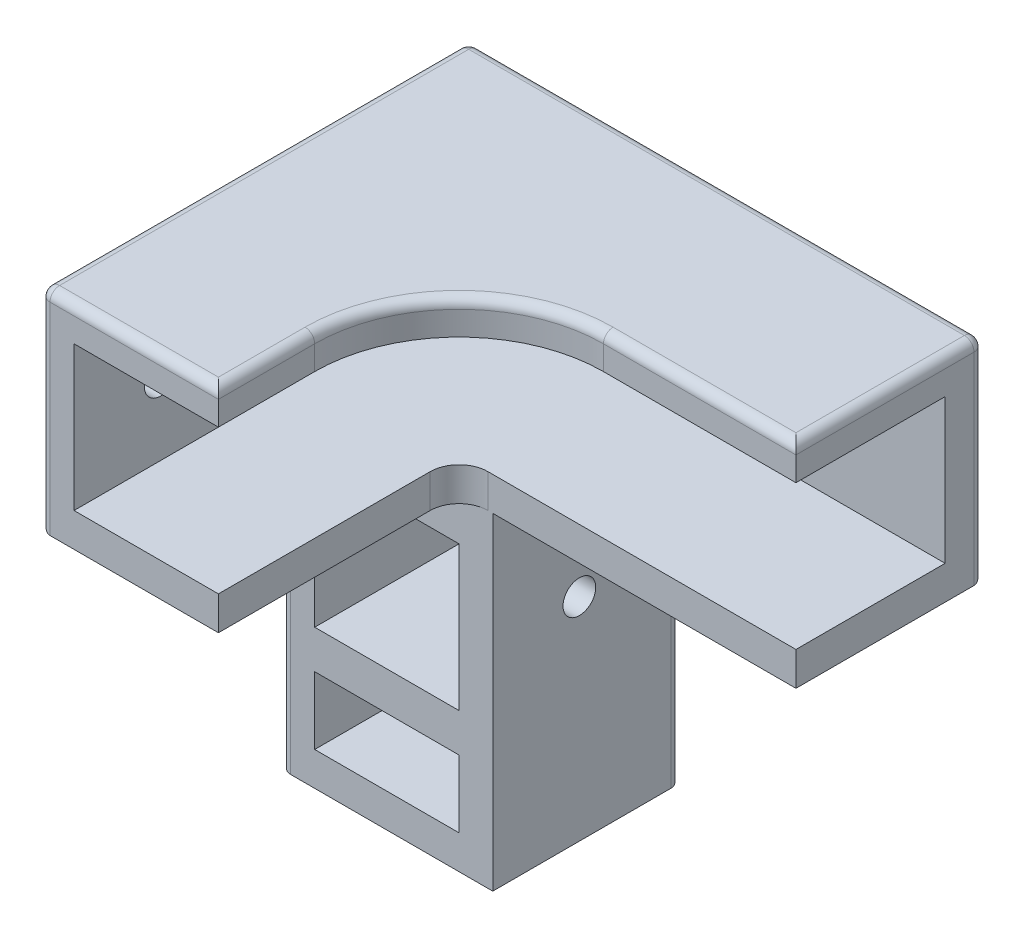
from build123d import *

# Parameters (mm, degrees)
BOSS_EXTRUDE1_DEPTH  = 19.5
SKETCH3_W            = 18.5
SKETCH3_H            = 22
BOSS_EXTRUDE2_DEPTH  = 25
SKETCH5_W            = 50
SKETCH5_H            = 15
SKETCH5_W_2          = 15
SKETCH5_H_2          = 7
CUT_EXTRUDE1_DEPTH   = 40.5
BOSS_EXTRUDE4_DEPTH  = 3.5
BOSS_EXTRUDE5_DEPTH  = 3.5
BOSS_EXTRUDE6_DEPTH  = 3.5
FILLET3_R            = 3
CUT_EXTRUDE3_DEPTH   = 1
SKETCH12_R           = 1.7
CUT_EXTRUDE4_DEPTH   = 5
SKETCH13_R           = 1.7
CUT_EXTRUDE5_DEPTH   = 45
SKETCH14_R           = 1.7
CUT_EXTRUDE6_DEPTH   = 45
SKETCH15_R           = 1.7
CUT_EXTRUDE7_DEPTH   = 4
FILLET3_OF_MIRROR2_R = 3
SKETCH16_W           = 70.294928241
SKETCH16_H           = 57.866283398
CUT_EXTRUDE8_DEPTH   = 72
CUT_EXTRUDE9_DEPTH   = 1
FILLET4_R            = 1


with BuildPart() as part:
    # Sketch1 → Boss-Extrude1 (new body)
    with BuildSketch(Plane.XY):
        Polygon((-5.699410772, 32.916253451), (16.300589228, 32.916253451), (16.300589228, -23.083746549), (-5.699410772, -23.083746549), (-5.699410772, 10.916253451), (-37.199410772, 10.916253451), (-37.199410772, 32.916253451), align=None)
    boss_extrude1 = extrude(amount=BOSS_EXTRUDE1_DEPTH)

    # Sketch3 → Boss-Extrude2 (add)
    with BuildSketch(Plane.XY.offset(19.5)):
        with Locations((7.050589228, 21.916253451)):
            Rectangle(SKETCH3_W, SKETCH3_H)
    boss_extrude2 = extrude(amount=BOSS_EXTRUDE2_DEPTH)

    # Sketch5 → Cut-Extrude1 (cut)
    with BuildSketch(Plane.XY.offset(44.5)):
        with Locations((-12.199410772, 21.916253451)):
            Rectangle(SKETCH5_W, SKETCH5_H)
        with Locations((5.300589228, -1.083746549)):
            Rectangle(SKETCH5_W_2, SKETCH5_H)
        with Locations((5.300589228, -16.083746549)):
            Rectangle(SKETCH5_W_2, SKETCH5_H_2)
    cut_extrude1 = extrude(amount=-CUT_EXTRUDE1_DEPTH, mode=Mode.SUBTRACT)

    # Sketch7 → Boss-Extrude4 (add)
    with BuildSketch(Plane(origin=(16.300589228, 0, 0), x_dir=(0, 0, -1), z_dir=(1, 0, 0))):
        with BuildLine():
            Line((-34.5, 10.916253451), (-19.5, 10.916253451))
            Line((-19.5, 10.916253451), (-19.5, -4.083746549))
            ThreePointArc((-19.5, -4.083746549), (-23.893398282, 6.522855169), (-34.5, 10.916253451))
        make_face()
    boss_extrude4 = extrude(amount=-BOSS_EXTRUDE4_DEPTH)

    # Sketch8 → Boss-Extrude5 (add)
    with BuildSketch(Plane(origin=(0, 0, 0), x_dir=(-1, 0, 0), z_dir=(0, 0, -1))):
        with BuildLine():
            Line((5.699410772, 10.916253451), (20.699410772, 10.916253451))
            ThreePointArc((20.699410772, 10.916253451), (10.092809055, 6.522855169), (5.699410772, -4.083746549))
            Line((5.699410772, -4.083746549), (5.699410772, 10.916253451))
        make_face()
    boss_extrude5 = extrude(amount=-BOSS_EXTRUDE5_DEPTH)

    # Sketch9 → Boss-Extrude6 (add)
    with BuildSketch(Plane(origin=(0, 32.916253451, 0), x_dir=(1, 0, 0), z_dir=(0, 1, 0))):
        with BuildLine():
            Line((-2.199410772, -34.5), (-2.199410772, -19.5))
            Line((-2.199410772, -19.5), (-17.199410772, -19.5))
            ThreePointArc((-17.199410772, -19.5), (-6.592809055, -23.893398282), (-2.199410772, -34.5))
        make_face()
    boss_extrude6 = extrude(amount=-BOSS_EXTRUDE6_DEPTH)

    # Fillet3
    fillet3_edges = [part.edges().sort_by_distance(p)[0] for p in [
        (-2.199410772, 12.666253451, 19.5),
    ]]
    fillet(fillet3_edges, radius=FILLET3_R)

    # Sketch11 → Cut-Extrude3 (cut)
    # profile 1 of 4: a face of its own
    with BuildSketch(Plane(origin=(0, 0, 0), x_dir=(-1, 0, 0), z_dir=(0, 0, -1))):
        Polygon((-10.800589228, -18.789996549), (-10.800589228, -16.838073472), (-2.43039692, -14.652977318), (-10.800589228, -12.463073472), (-10.800589228, -10.515958087), (1.199410772, -8.729900395), (1.199410772, -10.602496549), (-6.379916151, -11.729900395), (1.199410772, -13.715477318), (1.199410772, -15.597688857), (-6.379916151, -17.576054241), (1.199410772, -18.703458087), (1.199410772, -20.576054241), align=None)
    # profile 2 of 4: a face of its own
    with BuildSketch(Plane(origin=(0, 0, 0), x_dir=(-1, 0, 0), z_dir=(0, 0, -1))):
        with BuildLine():
            Line((-10.800589228, -7.991438857), (-10.800589228, -5.952977318))
            add(Edge.make_bspline(
                [(-10.800589228, -5.952977318), (-10.800005012, -5.818337024), (-10.798881276, -5.559357226), (-10.780939362, -5.185841664), (-10.756194453, -4.841644627), (-10.717588986, -4.528141475), (-10.670910939, -4.244422827), (-10.610297955, -3.991812577), (-10.542991354, -3.767135176), (-10.432899575, -3.510089545), (-10.261344606, -3.2204116), (-9.993854575, -2.916502166), (-9.674999978, -2.642644015), (-9.298421338, -2.412342144), (-8.876833149, -2.221736808), (-8.412796045, -2.089022583), (-7.914245505, -2.00467731), (-7.569376461, -1.995936272), (-7.391935381, -1.991438857)],
                knots=[0, 0, 0, 0, 1.067446855, 2.053227611, 2.964447842, 3.802928181, 4.55705831, 5.242813606, 5.861740442, 6.41401137, 7.456762865, 8.515266784, 9.610284097, 10.777391769, 12.003071174, 13.267653188, 14.594160368, 16, 16, 16, 16], degree=3))
            add(Edge.make_bspline(
                [(-7.391935381, -1.991438857), (-7.297355032, -1.992855248), (-7.111944506, -1.99563187), (-6.839545611, -2.016474255), (-6.57922187, -2.056818659), (-6.329385024, -2.104637483), (-6.092864844, -2.173393793), (-5.86736032, -2.254741183), (-5.654862929, -2.353204183), (-5.453365078, -2.465039747), (-5.262464902, -2.588608019), (-5.086843378, -2.732896484), (-4.9205107, -2.888692529), (-4.766123648, -3.059365613), (-4.626046251, -3.246963608), (-4.496602326, -3.448494847), (-4.377999142, -3.665222723), (-4.310704173, -3.817832702), (-4.276550766, -3.895285011)],
                knots=[0, 0, 0, 0, 1.163181294, 2.28024169, 3.356120165, 4.401649984, 5.406013808, 6.381787017, 7.347406326, 8.282525473, 9.21452408, 10.139462981, 11.073595085, 12.01554303, 12.965498088, 13.949545959, 14.959357709, 16, 16, 16, 16], degree=3))
            Line((-4.276550766, -3.895285011), (1.199410772, -1.452977318))
            Line((1.199410772, -1.452977318), (1.199410772, -3.541919626))
            Line((1.199410772, -3.541919626), (-4.031358458, -5.873650395))
            Line((-4.031358458, -5.873650395), (-4.031358458, -6.145285011))
            Line((-4.031358458, -6.145285011), (1.199410772, -6.145285011))
            Line((1.199410772, -6.145285011), (1.199410772, -7.991438857))
            Line((1.199410772, -7.991438857), (-10.800589228, -7.991438857))
        make_face()
        with BuildLine():
            Line((-6.185204612, -6.145285011), (-6.185204612, -5.515477318))
            add(Edge.make_bspline(
                [(-6.185204612, -5.515477318), (-6.186367141, -5.438550003), (-6.188596807, -5.291007573), (-6.198784481, -5.078941418), (-6.223636793, -4.886497292), (-6.255016899, -4.712471663), (-6.291026717, -4.555276318), (-6.342625913, -4.418389599), (-6.399049431, -4.298462814), (-6.489896288, -4.166118437), (-6.633796999, -4.027471922), (-6.856716063, -3.91397639), (-7.124487444, -3.84724369), (-7.317795964, -3.840947182), (-7.420781535, -3.837592703)],
                knots=[0, 0, 0, 0, 1.14443165, 2.194958024, 3.155864406, 4.02787753, 4.825710302, 5.549708663, 6.200008757, 6.791751392, 7.929772656, 9.129352395, 10.470655706, 12, 12, 12, 12], degree=3))
            add(Edge.make_bspline(
                [(-7.420781535, -3.837592703), (-7.484265153, -3.839856392), (-7.607360624, -3.844245712), (-7.785755229, -3.879686188), (-7.952879051, -3.933201989), (-8.103735349, -4.014031264), (-8.239800846, -4.109799367), (-8.356212547, -4.223260262), (-8.450592564, -4.353040951), (-8.531146795, -4.502587927), (-8.586059735, -4.694350085), (-8.620716321, -4.939833657), (-8.644326337, -5.246603017), (-8.645891807, -5.472154526), (-8.646743074, -5.594804241)],
                knots=[0, 0, 0, 0, 0.9241003, 1.791841178, 2.640927318, 3.471185814, 4.274581995, 5.058835706, 5.827024317, 6.605084504, 7.520888769, 8.714677486, 10.213517293, 12, 12, 12, 12], degree=3))
            Line((-8.646743074, -5.594804241), (-8.646743074, -6.145285011))
            Line((-8.646743074, -6.145285011), (-6.185204612, -6.145285011))
        make_face(mode=Mode.SUBTRACT)
    # profile 3 of 4: a face of its own
    with BuildSketch(Plane(origin=(0, 0, 0), x_dir=(-1, 0, 0), z_dir=(0, 0, -1))):
        with BuildLine():
            add(Edge.make_bspline(
                [(-1.262127689, -0.176054241), (-1.257647984, -0.104101941), (-1.248753835, 0.038754448), (-1.172545764, 0.242235867), (-1.05033496, 0.427832621), (-0.88404186, 0.590235666), (-0.687299125, 0.730105266), (-0.462023761, 0.828247267), (-0.217504351, 0.891566147), (-0.046993635, 0.897708021), (0.040756926, 0.900868836)],
                knots=[0, 0, 0, 0, 0.919349048, 1.825304879, 2.744940427, 3.746623331, 4.786044724, 5.819977252, 6.878086821, 8, 8, 8, 8], degree=3))
            add(Edge.make_bspline(
                [(0.040756926, 0.900868836), (0.128481887, 0.897613897), (0.299721778, 0.891260229), (0.545324854, 0.828809783), (0.771582895, 0.729449747), (0.970335119, 0.590396057), (1.138671939, 0.427821465), (1.264004419, 0.242957175), (1.339760461, 0.038678283), (1.348736151, -0.104127453), (1.353256926, -0.176054241)],
                knots=[0, 0, 0, 0, 1.117536417, 2.181440851, 3.211339843, 4.255104211, 5.260135653, 6.181815925, 7.084237479, 8, 8, 8, 8], degree=3))
            add(Edge.make_bspline(
                [(1.353256926, -0.176054241), (1.348770157, -0.248001687), (1.339861983, -0.390848436), (1.263364391, -0.595455675), (1.139460356, -0.781986068), (0.970956709, -0.945114294), (0.77080448, -1.081189928), (0.54542444, -1.181069939), (0.299695058, -1.243328016), (0.128472836, -1.249708594), (0.040756926, -1.252977318)],
                knots=[0, 0, 0, 0, 0.915447906, 1.817559426, 2.747445231, 3.752131388, 4.789763433, 5.819308596, 6.882847519, 8, 8, 8, 8], degree=3))
            add(Edge.make_bspline(
                [(0.040756926, -1.252977318), (-0.046984438, -1.249802679), (-0.217477284, -1.243633944), (-0.462123928, -1.180506316), (-0.686511891, -1.081845741), (-0.884668075, -0.944947749), (-1.051117925, -0.781983335), (-1.171904853, -0.594743665), (-1.248854997, -0.390923093), (-1.257681869, -0.248026694), (-1.262127689, -0.176054241)],
                knots=[0, 0, 0, 0, 1.121525552, 2.179269538, 3.212844836, 4.246063491, 5.247400307, 6.175325774, 7.080968592, 8, 8, 8, 8], degree=3))
        make_face()
    # profile 4 of 4: a face of its own
    with BuildSketch(Plane(origin=(0, 0, 0), x_dir=(-1, 0, 0), z_dir=(0, 0, -1))):
        with BuildLine():
            Line((-7.877512305, 3.639330374), (-7.877512305, 1.793176528))
            add(Edge.make_bspline(
                [(-7.877512305, 1.793176528), (-7.985104597, 1.806156245), (-8.194919789, 1.831467926), (-8.50062502, 1.89307865), (-8.789725475, 1.969009097), (-9.063857289, 2.060670567), (-9.32041803, 2.168002956), (-9.560895844, 2.292709709), (-9.787587098, 2.42930416), (-9.925017131, 2.537709574), (-9.99289692, 2.591253451)],
                knots=[0, 0, 0, 0, 1.13409845, 2.211599726, 3.261451197, 4.261463951, 5.235132031, 6.169264622, 7.095758548, 8, 8, 8, 8], degree=3))
            add(Edge.make_bspline(
                [(-9.99289692, 2.591253451), (-10.082013161, 2.667910273), (-10.256359415, 2.817881026), (-10.483761061, 3.07110519), (-10.676767562, 3.337669411), (-10.835123876, 3.619879277), (-10.958228421, 3.915924445), (-11.044683072, 4.227572925), (-11.099664631, 4.553240287), (-11.10537913, 4.776126179), (-11.108281535, 4.889330374)],
                knots=[0, 0, 0, 0, 1.065406432, 2.084352066, 3.078868942, 4.045367136, 5.013203651, 5.979674514, 6.9738726, 8, 8, 8, 8], degree=3))
            add(Edge.make_bspline(
                [(-11.108281535, 4.889330374), (-11.105554752, 4.990429502), (-11.100204953, 5.188780494), (-11.056686246, 5.480236578), (-10.97985421, 5.757907044), (-10.8818086, 6.026068289), (-10.745230943, 6.277428113), (-10.587175591, 6.520140361), (-10.396186865, 6.748620977), (-10.177194209, 6.959885993), (-9.943110555, 7.156839202), (-9.690759412, 7.324416021), (-9.43059281, 7.47074821), (-9.157422302, 7.588703888), (-8.873189212, 7.680392593), (-8.578388089, 7.744054748), (-8.273858918, 7.787935844), (-8.06677444, 7.791411893), (-7.96164692, 7.793176528)],
                knots=[0, 0, 0, 0, 1.018635126, 1.998506719, 2.96030997, 3.918683232, 4.868719089, 5.836268132, 6.834011598, 7.861887245, 8.899958098, 9.91230014, 10.909978245, 11.904579616, 12.905650751, 13.91466998, 14.941371293, 16, 16, 16, 16], degree=3))
            add(Edge.make_bspline(
                [(-7.96164692, 7.793176528), (-7.831571704, 7.7882504), (-7.575267724, 7.778543815), (-7.199658116, 7.710806724), (-6.842854452, 7.593710225), (-6.50564623, 7.43251906), (-6.191993909, 7.228071619), (-5.907939838, 6.979968911), (-5.654954295, 6.689672154), (-5.517272776, 6.469896674), (-5.447223843, 6.358080374)],
                knots=[0, 0, 0, 0, 1.027701034, 2.025011931, 3.004147813, 3.986880317, 4.970346872, 5.953160964, 6.958619193, 8, 8, 8, 8], degree=3))
            add(Edge.make_bspline(
                [(-5.447223843, 6.358080374), (-5.418934484, 6.430798423), (-5.362819656, 6.575042087), (-5.255412748, 6.779194324), (-5.134751997, 6.973329501), (-4.999067172, 7.154540458), (-4.847347238, 7.322970358), (-4.681616094, 7.478791827), (-4.500395305, 7.624150933), (-4.30375287, 7.755244697), (-4.095176448, 7.873355347), (-3.875726079, 7.97347104), (-3.648685489, 8.060719415), (-3.412791492, 8.133216192), (-3.166864793, 8.188590605), (-2.911254324, 8.225884056), (-2.647259211, 8.251365722), (-2.468118928, 8.253589988), (-2.377512305, 8.254714989)],
                knots=[0, 0, 0, 0, 0.971157749, 1.926390409, 2.867917292, 3.816032967, 4.741824403, 5.6878893, 6.646452846, 7.631864642, 8.628382992, 9.628642509, 10.633224323, 11.656081692, 12.699617594, 13.76949873, 14.871843985, 16, 16, 16, 16], degree=3))
            add(Edge.make_bspline(
                [(-2.377512305, 8.254714989), (-2.244325252, 8.252503818), (-1.981850533, 8.248146212), (-1.597044081, 8.197009582), (-1.226862615, 8.122689872), (-0.874542963, 8.009706698), (-0.536107314, 7.870492658), (-0.212201339, 7.699845341), (0.092892066, 7.493753909), (0.380575775, 7.261849568), (0.643411265, 7.006428676), (0.8765742, 6.732895346), (1.069672671, 6.437585756), (1.23223783, 6.128720843), (1.355158488, 5.799574581), (1.443839147, 5.455657192), (1.498563993, 5.093806224), (1.504216675, 4.847057422), (1.50710308, 4.721061143)],
                knots=[0, 0, 0, 0, 1.08934669, 2.146800001, 3.171892192, 4.175766193, 5.1695646, 6.164076811, 7.166278581, 8.178196077, 9.184573215, 10.16196427, 11.113242845, 12.066531174, 13.012937118, 13.981620827, 14.969363733, 16, 16, 16, 16], degree=3))
            add(Edge.make_bspline(
                [(1.50710308, 4.721061143), (1.504031919, 4.602279119), (1.498005885, 4.36921268), (1.44571629, 4.02762683), (1.362713421, 3.702437153), (1.243881772, 3.394298005), (1.091092441, 3.104692046), (0.906771997, 2.829859086), (0.687442467, 2.57259779), (0.434322499, 2.3350891), (0.15282569, 2.119255522), (-0.153407037, 1.926340908), (-0.483775783, 1.75924538), (-0.840338868, 1.624378739), (-1.217591782, 1.506817115), (-1.621739126, 1.421885121), (-2.049128635, 1.361769677), (-2.342880764, 1.341824077), (-2.49289692, 1.331638066)],
                knots=[0, 0, 0, 0, 0.974003266, 1.911126485, 2.827923683, 3.722775623, 4.613731572, 5.50894563, 6.432318302, 7.38099101, 8.351349308, 9.338047726, 10.346428225, 11.382873954, 12.462111462, 13.585146545, 14.766759469, 16, 16, 16, 16], degree=3))
            Line((-2.49289692, 1.331638066), (-2.49289692, 3.177791913))
            add(Edge.make_bspline(
                [(-2.49289692, 3.177791913), (-2.417425318, 3.188945376), (-2.270574462, 3.210647521), (-2.058705359, 3.256683558), (-1.861732034, 3.311165199), (-1.680044741, 3.376135049), (-1.514279405, 3.45120486), (-1.360798784, 3.532148117), (-1.223710633, 3.625749249), (-1.065384613, 3.762941693), (-0.896220111, 3.953356149), (-0.749458771, 4.217045491), (-0.662515335, 4.51137642), (-0.652102457, 4.7164657), (-0.646743074, 4.822022682)],
                knots=[0, 0, 0, 0, 1.004083628, 1.953722164, 2.852062002, 3.692886634, 4.490800013, 5.245942238, 5.974461452, 6.670088602, 8.000762069, 9.303976857, 10.612389357, 12, 12, 12, 12], degree=3))
            add(Edge.make_bspline(
                [(-0.646743074, 4.822022682), (-0.647864371, 4.878202331), (-0.650053976, 4.987906785), (-0.675076379, 5.149181645), (-0.716357012, 5.302683497), (-0.770574005, 5.45033855), (-0.844338553, 5.58810378), (-0.931901508, 5.719433893), (-1.034609515, 5.844770146), (-1.195110626, 5.995917646), (-1.416786421, 6.163242766), (-1.719322479, 6.30573827), (-2.050588673, 6.3928176), (-2.280814454, 6.403216349), (-2.39914692, 6.408561143)],
                knots=[0, 0, 0, 0, 0.766703657, 1.497175717, 2.221804895, 2.935192376, 3.640052165, 4.350243223, 5.088623085, 5.847082799, 7.357237736, 8.859920549, 10.386048059, 12, 12, 12, 12], degree=3))
            add(Edge.make_bspline(
                [(-2.39914692, 6.408561143), (-2.464945748, 6.406711942), (-2.594787133, 6.403062896), (-2.786195597, 6.374088866), (-2.969648465, 6.322755274), (-3.145763747, 6.253440485), (-3.312932079, 6.163011753), (-3.473227413, 6.054384045), (-3.62413007, 5.923172242), (-3.768170684, 5.775714059), (-3.898710135, 5.608114668), (-4.014720541, 5.423570124), (-4.109640596, 5.219059789), (-4.193220285, 4.999736952), (-4.254214347, 4.760765565), (-4.29872396, 4.505093902), (-4.332010414, 4.232310528), (-4.336655471, 4.044084373), (-4.339050766, 3.947022682)],
                knots=[0, 0, 0, 0, 0.899536996, 1.775063972, 2.638995881, 3.499655969, 4.357521698, 5.232774386, 6.141935922, 7.087285127, 8.047315231, 9.041502366, 10.060909586, 11.125312509, 12.246833879, 13.426779274, 14.673079445, 16, 16, 16, 16], degree=3))
            Line((-4.339050766, 3.947022682), (-6.339050766, 3.947022682))
            add(Edge.make_bspline(
                [(-6.339050766, 3.947022682), (-6.351211097, 4.070597942), (-6.374042407, 4.302613426), (-6.427589871, 4.624478183), (-6.497441604, 4.896812425), (-6.588065699, 5.121571579), (-6.694964612, 5.310796304), (-6.816990742, 5.474794656), (-6.9584857, 5.616776513), (-7.116669669, 5.733391795), (-7.285211073, 5.826558536), (-7.45907096, 5.899690982), (-7.641166228, 5.937102036), (-7.763594277, 5.943722311), (-7.824627689, 5.947022682)],
                knots=[0, 0, 0, 0, 1.613490305, 3.029366345, 4.236845818, 5.259854129, 6.169213254, 7.054399038, 7.908596932, 8.76463379, 9.599115534, 10.407455461, 11.206077139, 12, 12, 12, 12], degree=3))
            add(Edge.make_bspline(
                [(-7.824627689, 5.947022682), (-7.902708499, 5.94339984), (-8.054533682, 5.93635536), (-8.271474473, 5.879601033), (-8.4685132, 5.787571995), (-8.638517306, 5.657006158), (-8.780104567, 5.497937744), (-8.882578523, 5.311699797), (-8.945232074, 5.101614866), (-8.951293618, 4.953882443), (-8.954435381, 4.877311143)],
                knots=[0, 0, 0, 0, 1.073009827, 2.08642706, 3.062829201, 4.046239177, 5.014892964, 5.972187552, 6.948963055, 8, 8, 8, 8], degree=3))
            add(Edge.make_bspline(
                [(-8.954435381, 4.877311143), (-8.95071032, 4.808009077), (-8.94335375, 4.671145417), (-8.884755184, 4.47123759), (-8.789639268, 4.281474968), (-8.656940841, 4.105904867), (-8.497545942, 3.947245812), (-8.310497414, 3.816432348), (-8.104113715, 3.708690565), (-7.953735758, 3.662661532), (-7.877512305, 3.639330374)],
                knots=[0, 0, 0, 0, 0.942455657, 1.861242209, 2.81281304, 3.818879151, 4.845099048, 5.862404497, 6.916497371, 8, 8, 8, 8], degree=3))
        make_face()
    extrude(amount=-CUT_EXTRUDE3_DEPTH, mode=Mode.SUBTRACT)

    # Sketch12 → Cut-Extrude4 (cut)
    with BuildSketch(Plane(origin=(0, 0, 0), x_dir=(-1, 0, 0), z_dir=(0, 0, -1))):
        with Locations((-5.300589228, 21.916253451)):
            Circle(SKETCH12_R)
        with Locations((10.949410772, 21.916253451)):
            Circle(SKETCH12_R)
        with Locations((27.199410772, 21.916253451)):
            Circle(SKETCH12_R)
    cut_extrude4 = extrude(amount=-CUT_EXTRUDE4_DEPTH, mode=Mode.SUBTRACT)

    # Sketch13 → Cut-Extrude5 (cut)
    with BuildSketch(Plane.ZY.offset(5.699410772)):
        with Locations(Location((10.5, -1.083746549, 0), (0, 0, 270))):
            Circle(SKETCH13_R)
    cut_extrude5 = extrude(amount=-CUT_EXTRUDE5_DEPTH, mode=Mode.SUBTRACT)

    # Sketch14 → Cut-Extrude6 (cut)
    with BuildSketch(Plane(origin=(16.300589228, 0, 0), x_dir=(0, 0, -1), z_dir=(1, 0, 0))):
        with Locations(Location((-10.5, 21.916253451, 0), (0, 0, 90))):
            Circle(SKETCH14_R)
        with Locations(Location((-35.5, 21.916253451, 0), (0, 0, 90))):
            Circle(SKETCH14_R)
    cut_extrude6 = extrude(amount=-CUT_EXTRUDE6_DEPTH, mode=Mode.SUBTRACT)

    # Sketch15 → Cut-Extrude7 (cut)
    with BuildSketch(Plane.XZ.offset(23.083746549)):
        with Locations(Location((5.300589228, 9.75, 0), (0, 0, 270))):
            Circle(SKETCH15_R)
    cut_extrude7 = extrude(amount=-CUT_EXTRUDE7_DEPTH, mode=Mode.SUBTRACT)

    # Mirror2: Boss-Extrude1, Boss-Extrude2, Cut-Extrude1, Boss-Extrude4, Boss-Extrude5, Boss-Extrude6, Cut-Extrude4, Cut-Extrude5, Cut-Extrude6, Cut-Extrude7 across plane
    add(boss_extrude1.mirror(Plane(origin=(16.300589228, 32.916253451, 19.5), x_dir=(0, 0, 1), z_dir=(-1, 0, 0))))
    add(boss_extrude2.mirror(Plane(origin=(16.300589228, 32.916253451, 19.5), x_dir=(0, 0, 1), z_dir=(-1, 0, 0))))
    add(cut_extrude1.mirror(Plane(origin=(16.300589228, 32.916253451, 19.5), x_dir=(0, 0, 1), z_dir=(-1, 0, 0))), mode=Mode.SUBTRACT)
    add(boss_extrude4.mirror(Plane(origin=(16.300589228, 32.916253451, 19.5), x_dir=(0, 0, 1), z_dir=(-1, 0, 0))))
    add(boss_extrude5.mirror(Plane(origin=(16.300589228, 32.916253451, 19.5), x_dir=(0, 0, 1), z_dir=(-1, 0, 0))))
    add(boss_extrude6.mirror(Plane(origin=(16.300589228, 32.916253451, 19.5), x_dir=(0, 0, 1), z_dir=(-1, 0, 0))))
    add(cut_extrude4.mirror(Plane(origin=(16.300589228, 32.916253451, 19.5), x_dir=(0, 0, 1), z_dir=(-1, 0, 0))), mode=Mode.SUBTRACT)
    add(cut_extrude5.mirror(Plane(origin=(16.300589228, 32.916253451, 19.5), x_dir=(0, 0, 1), z_dir=(-1, 0, 0))), mode=Mode.SUBTRACT)
    add(cut_extrude6.mirror(Plane(origin=(16.300589228, 32.916253451, 19.5), x_dir=(0, 0, 1), z_dir=(-1, 0, 0))), mode=Mode.SUBTRACT)
    add(cut_extrude7.mirror(Plane(origin=(16.300589228, 32.916253451, 19.5), x_dir=(0, 0, 1), z_dir=(-1, 0, 0))), mode=Mode.SUBTRACT)

    # Fillet3 of Mirror2
    fillet3_of_mirror2_edges = [part.edges().sort_by_distance(p)[0] for p in [
        (34.800589228, 12.666253451, 19.5),
    ]]
    fillet(fillet3_of_mirror2_edges, radius=FILLET3_OF_MIRROR2_R)

    # Sketch16 → Cut-Extrude8 (cut)
    with BuildSketch(Plane(origin=(0, 0, 0), x_dir=(-1, 0, 0), z_dir=(0, 0, -1))):
        with Locations((18.846874893, 3.983111752)):
            Rectangle(SKETCH16_W, SKETCH16_H)
    extrude(amount=-CUT_EXTRUDE8_DEPTH, mode=Mode.SUBTRACT)

    # Sketch20 → Cut-Extrude9 (cut)
    # profile 1 of 4: a face of its own
    with BuildSketch(Plane(origin=(0, 0, 0), x_dir=(-1, 0, 0), z_dir=(0, 0, -1))):
        Polygon((-32.800589228, -18.789996549), (-32.800589228, -16.838073472), (-24.43039692, -14.652977318), (-32.800589228, -12.463073472), (-32.800589228, -10.515958087), (-20.800589228, -8.729900395), (-20.800589228, -10.602496549), (-28.379916151, -11.729900395), (-20.800589228, -13.715477318), (-20.800589228, -15.597688857), (-28.379916151, -17.576054241), (-20.800589228, -18.703458087), (-20.800589228, -20.576054241), align=None)
    # profile 2 of 4: a face of its own
    with BuildSketch(Plane(origin=(0, 0, 0), x_dir=(-1, 0, 0), z_dir=(0, 0, -1))):
        with BuildLine():
            Line((-32.800589228, -7.991438857), (-32.800589228, -5.952977318))
            add(Edge.make_bspline(
                [(-32.800589228, -5.952977318), (-32.800005012, -5.818337024), (-32.798881276, -5.559357226), (-32.780939362, -5.185841664), (-32.756194453, -4.841644627), (-32.717588986, -4.528141475), (-32.670910939, -4.244422827), (-32.610297955, -3.991812577), (-32.542991354, -3.767135176), (-32.432899575, -3.510089545), (-32.261344606, -3.2204116), (-31.993854575, -2.916502166), (-31.674999978, -2.642644015), (-31.298421338, -2.412342144), (-30.876833149, -2.221736808), (-30.412796045, -2.089022583), (-29.914245505, -2.00467731), (-29.569376461, -1.995936272), (-29.391935381, -1.991438857)],
                knots=[0, 0, 0, 0, 1.067446855, 2.053227611, 2.964447842, 3.802928181, 4.55705831, 5.242813606, 5.861740442, 6.41401137, 7.456762865, 8.515266784, 9.610284097, 10.777391769, 12.003071174, 13.267653188, 14.594160368, 16, 16, 16, 16], degree=3))
            add(Edge.make_bspline(
                [(-29.391935381, -1.991438857), (-29.297355032, -1.992855248), (-29.111944506, -1.99563187), (-28.839545611, -2.016474255), (-28.57922187, -2.056818659), (-28.329385024, -2.104637483), (-28.092864844, -2.173393793), (-27.86736032, -2.254741183), (-27.654862929, -2.353204183), (-27.453365078, -2.465039747), (-27.262464902, -2.588608019), (-27.086843378, -2.732896484), (-26.9205107, -2.888692529), (-26.766123648, -3.059365613), (-26.626046251, -3.246963608), (-26.496602326, -3.448494847), (-26.377999142, -3.665222723), (-26.310704173, -3.817832702), (-26.276550766, -3.895285011)],
                knots=[0, 0, 0, 0, 1.163181294, 2.28024169, 3.356120165, 4.401649984, 5.406013808, 6.381787017, 7.347406326, 8.282525473, 9.21452408, 10.139462981, 11.073595085, 12.01554303, 12.965498088, 13.949545959, 14.959357709, 16, 16, 16, 16], degree=3))
            Line((-26.276550766, -3.895285011), (-20.800589228, -1.452977318))
            Line((-20.800589228, -1.452977318), (-20.800589228, -3.541919626))
            Line((-20.800589228, -3.541919626), (-26.031358458, -5.873650395))
            Line((-26.031358458, -5.873650395), (-26.031358458, -6.145285011))
            Line((-26.031358458, -6.145285011), (-20.800589228, -6.145285011))
            Line((-20.800589228, -6.145285011), (-20.800589228, -7.991438857))
            Line((-20.800589228, -7.991438857), (-32.800589228, -7.991438857))
        make_face()
        with BuildLine():
            Line((-28.185204612, -6.145285011), (-28.185204612, -5.515477318))
            add(Edge.make_bspline(
                [(-28.185204612, -5.515477318), (-28.186367141, -5.438550003), (-28.188596807, -5.291007573), (-28.198784481, -5.078941418), (-28.223636793, -4.886497292), (-28.255016899, -4.712471663), (-28.291026717, -4.555276318), (-28.342625913, -4.418389599), (-28.399049431, -4.298462814), (-28.489896288, -4.166118437), (-28.633796999, -4.027471922), (-28.856716063, -3.91397639), (-29.124487444, -3.84724369), (-29.317795964, -3.840947182), (-29.420781535, -3.837592703)],
                knots=[0, 0, 0, 0, 1.14443165, 2.194958024, 3.155864406, 4.02787753, 4.825710302, 5.549708663, 6.200008757, 6.791751392, 7.929772656, 9.129352395, 10.470655706, 12, 12, 12, 12], degree=3))
            add(Edge.make_bspline(
                [(-29.420781535, -3.837592703), (-29.484265153, -3.839856392), (-29.607360624, -3.844245712), (-29.785755229, -3.879686188), (-29.952879051, -3.933201989), (-30.103735349, -4.014031264), (-30.239800846, -4.109799367), (-30.356212547, -4.223260262), (-30.450592564, -4.353040951), (-30.531146795, -4.502587927), (-30.586059735, -4.694350085), (-30.620716321, -4.939833657), (-30.644326337, -5.246603017), (-30.645891807, -5.472154526), (-30.646743074, -5.594804241)],
                knots=[0, 0, 0, 0, 0.9241003, 1.791841178, 2.640927318, 3.471185814, 4.274581995, 5.058835706, 5.827024317, 6.605084504, 7.520888769, 8.714677486, 10.213517293, 12, 12, 12, 12], degree=3))
            Line((-30.646743074, -5.594804241), (-30.646743074, -6.145285011))
            Line((-30.646743074, -6.145285011), (-28.185204612, -6.145285011))
        make_face(mode=Mode.SUBTRACT)
    # profile 3 of 4: a face of its own
    with BuildSketch(Plane(origin=(0, 0, 0), x_dir=(-1, 0, 0), z_dir=(0, 0, -1))):
        with BuildLine():
            add(Edge.make_bspline(
                [(-23.262127689, -0.176054241), (-23.257647984, -0.104101941), (-23.248753835, 0.038754448), (-23.172545764, 0.242235867), (-23.05033496, 0.427832621), (-22.88404186, 0.590235666), (-22.687299125, 0.730105266), (-22.462023761, 0.828247267), (-22.217504351, 0.891566147), (-22.046993635, 0.897708021), (-21.959243074, 0.900868836)],
                knots=[0, 0, 0, 0, 0.919349048, 1.825304879, 2.744940427, 3.746623331, 4.786044724, 5.819977252, 6.878086821, 8, 8, 8, 8], degree=3))
            add(Edge.make_bspline(
                [(-21.959243074, 0.900868836), (-21.871518113, 0.897613897), (-21.700278222, 0.891260229), (-21.454675146, 0.828809783), (-21.228417105, 0.729449747), (-21.029664881, 0.590396057), (-20.861328061, 0.427821465), (-20.735995581, 0.242957175), (-20.660239539, 0.038678283), (-20.651263849, -0.104127453), (-20.646743074, -0.176054241)],
                knots=[0, 0, 0, 0, 1.117536417, 2.181440851, 3.211339843, 4.255104211, 5.260135653, 6.181815925, 7.084237479, 8, 8, 8, 8], degree=3))
            add(Edge.make_bspline(
                [(-20.646743074, -0.176054241), (-20.651229843, -0.248001687), (-20.660138017, -0.390848436), (-20.736635609, -0.595455675), (-20.860539644, -0.781986068), (-21.029043291, -0.945114294), (-21.22919552, -1.081189928), (-21.45457556, -1.181069939), (-21.700304942, -1.243328016), (-21.871527164, -1.249708594), (-21.959243074, -1.252977318)],
                knots=[0, 0, 0, 0, 0.915447906, 1.817559426, 2.747445231, 3.752131388, 4.789763433, 5.819308596, 6.882847519, 8, 8, 8, 8], degree=3))
            add(Edge.make_bspline(
                [(-21.959243074, -1.252977318), (-22.046984438, -1.249802679), (-22.217477284, -1.243633944), (-22.462123928, -1.180506316), (-22.686511891, -1.081845741), (-22.884668075, -0.944947749), (-23.051117925, -0.781983335), (-23.171904853, -0.594743665), (-23.248854997, -0.390923093), (-23.257681869, -0.248026694), (-23.262127689, -0.176054241)],
                knots=[0, 0, 0, 0, 1.121525552, 2.179269538, 3.212844836, 4.246063491, 5.247400307, 6.175325774, 7.080968592, 8, 8, 8, 8], degree=3))
        make_face()
    # profile 4 of 4: a face of its own
    with BuildSketch(Plane(origin=(0, 0, 0), x_dir=(-1, 0, 0), z_dir=(0, 0, -1))):
        with BuildLine():
            Line((-29.877512305, 3.639330374), (-29.877512305, 1.793176528))
            add(Edge.make_bspline(
                [(-29.877512305, 1.793176528), (-29.985104597, 1.806156245), (-30.194919789, 1.831467926), (-30.50062502, 1.89307865), (-30.789725475, 1.969009097), (-31.063857289, 2.060670567), (-31.32041803, 2.168002956), (-31.560895844, 2.292709709), (-31.787587098, 2.42930416), (-31.925017131, 2.537709574), (-31.99289692, 2.591253451)],
                knots=[0, 0, 0, 0, 1.13409845, 2.211599726, 3.261451197, 4.261463951, 5.235132031, 6.169264622, 7.095758548, 8, 8, 8, 8], degree=3))
            add(Edge.make_bspline(
                [(-31.99289692, 2.591253451), (-32.082013161, 2.667910273), (-32.256359415, 2.817881026), (-32.483761061, 3.07110519), (-32.676767562, 3.337669411), (-32.835123876, 3.619879277), (-32.958228421, 3.915924445), (-33.044683072, 4.227572925), (-33.099664631, 4.553240287), (-33.10537913, 4.776126179), (-33.108281535, 4.889330374)],
                knots=[0, 0, 0, 0, 1.065406432, 2.084352066, 3.078868942, 4.045367136, 5.013203651, 5.979674514, 6.9738726, 8, 8, 8, 8], degree=3))
            add(Edge.make_bspline(
                [(-33.108281535, 4.889330374), (-33.105554752, 4.990429502), (-33.100204953, 5.188780494), (-33.056686246, 5.480236578), (-32.97985421, 5.757907044), (-32.8818086, 6.026068289), (-32.745230943, 6.277428113), (-32.587175591, 6.520140361), (-32.396186865, 6.748620977), (-32.177194209, 6.959885993), (-31.943110555, 7.156839202), (-31.690759412, 7.324416021), (-31.43059281, 7.47074821), (-31.157422302, 7.588703888), (-30.873189212, 7.680392593), (-30.578388089, 7.744054748), (-30.273858918, 7.787935844), (-30.06677444, 7.791411893), (-29.96164692, 7.793176528)],
                knots=[0, 0, 0, 0, 1.018635126, 1.998506719, 2.96030997, 3.918683232, 4.868719089, 5.836268132, 6.834011598, 7.861887245, 8.899958098, 9.91230014, 10.909978245, 11.904579616, 12.905650751, 13.91466998, 14.941371293, 16, 16, 16, 16], degree=3))
            add(Edge.make_bspline(
                [(-29.96164692, 7.793176528), (-29.831571704, 7.7882504), (-29.575267724, 7.778543815), (-29.199658116, 7.710806724), (-28.842854452, 7.593710225), (-28.50564623, 7.43251906), (-28.191993909, 7.228071619), (-27.907939838, 6.979968911), (-27.654954295, 6.689672154), (-27.517272776, 6.469896674), (-27.447223843, 6.358080374)],
                knots=[0, 0, 0, 0, 1.027701034, 2.025011931, 3.004147813, 3.986880317, 4.970346872, 5.953160964, 6.958619193, 8, 8, 8, 8], degree=3))
            add(Edge.make_bspline(
                [(-27.447223843, 6.358080374), (-27.418934484, 6.430798423), (-27.362819656, 6.575042087), (-27.255412748, 6.779194324), (-27.134751997, 6.973329501), (-26.999067172, 7.154540458), (-26.847347238, 7.322970358), (-26.681616094, 7.478791827), (-26.500395305, 7.624150933), (-26.30375287, 7.755244697), (-26.095176448, 7.873355347), (-25.875726079, 7.97347104), (-25.648685489, 8.060719415), (-25.412791492, 8.133216192), (-25.166864793, 8.188590605), (-24.911254324, 8.225884056), (-24.647259211, 8.251365722), (-24.468118928, 8.253589988), (-24.377512305, 8.254714989)],
                knots=[0, 0, 0, 0, 0.971157749, 1.926390409, 2.867917292, 3.816032967, 4.741824403, 5.6878893, 6.646452846, 7.631864642, 8.628382992, 9.628642509, 10.633224323, 11.656081692, 12.699617594, 13.76949873, 14.871843985, 16, 16, 16, 16], degree=3))
            add(Edge.make_bspline(
                [(-24.377512305, 8.254714989), (-24.244325252, 8.252503818), (-23.981850533, 8.248146212), (-23.597044081, 8.197009582), (-23.226862615, 8.122689872), (-22.874542963, 8.009706698), (-22.536107314, 7.870492658), (-22.212201339, 7.699845341), (-21.907107934, 7.493753909), (-21.619424225, 7.261849568), (-21.356588735, 7.006428676), (-21.1234258, 6.732895346), (-20.930327329, 6.437585756), (-20.76776217, 6.128720843), (-20.644841512, 5.799574581), (-20.556160853, 5.455657192), (-20.501436007, 5.093806224), (-20.495783325, 4.847057422), (-20.49289692, 4.721061143)],
                knots=[0, 0, 0, 0, 1.08934669, 2.146800001, 3.171892192, 4.175766193, 5.1695646, 6.164076811, 7.166278581, 8.178196077, 9.184573215, 10.16196427, 11.113242845, 12.066531174, 13.012937118, 13.981620827, 14.969363733, 16, 16, 16, 16], degree=3))
            add(Edge.make_bspline(
                [(-20.49289692, 4.721061143), (-20.495968081, 4.602279119), (-20.501994115, 4.36921268), (-20.55428371, 4.02762683), (-20.637286579, 3.702437153), (-20.756118228, 3.394298005), (-20.908907559, 3.104692046), (-21.093228003, 2.829859086), (-21.312557533, 2.57259779), (-21.565677501, 2.3350891), (-21.84717431, 2.119255522), (-22.153407037, 1.926340908), (-22.483775783, 1.75924538), (-22.840338868, 1.624378739), (-23.217591782, 1.506817115), (-23.621739126, 1.421885121), (-24.049128635, 1.361769677), (-24.342880764, 1.341824077), (-24.49289692, 1.331638066)],
                knots=[0, 0, 0, 0, 0.974003266, 1.911126485, 2.827923683, 3.722775623, 4.613731572, 5.50894563, 6.432318302, 7.38099101, 8.351349308, 9.338047726, 10.346428225, 11.382873954, 12.462111462, 13.585146545, 14.766759469, 16, 16, 16, 16], degree=3))
            Line((-24.49289692, 1.331638066), (-24.49289692, 3.177791913))
            add(Edge.make_bspline(
                [(-24.49289692, 3.177791913), (-24.417425318, 3.188945376), (-24.270574462, 3.210647521), (-24.058705359, 3.256683558), (-23.861732034, 3.311165199), (-23.680044741, 3.376135049), (-23.514279405, 3.45120486), (-23.360798784, 3.532148117), (-23.223710633, 3.625749249), (-23.065384613, 3.762941693), (-22.896220111, 3.953356149), (-22.749458771, 4.217045491), (-22.662515335, 4.51137642), (-22.652102457, 4.7164657), (-22.646743074, 4.822022682)],
                knots=[0, 0, 0, 0, 1.004083628, 1.953722164, 2.852062002, 3.692886634, 4.490800013, 5.245942238, 5.974461452, 6.670088602, 8.000762069, 9.303976857, 10.612389357, 12, 12, 12, 12], degree=3))
            add(Edge.make_bspline(
                [(-22.646743074, 4.822022682), (-22.647864371, 4.878202331), (-22.650053976, 4.987906785), (-22.675076379, 5.149181645), (-22.716357012, 5.302683497), (-22.770574005, 5.45033855), (-22.844338553, 5.58810378), (-22.931901508, 5.719433893), (-23.034609515, 5.844770146), (-23.195110626, 5.995917646), (-23.416786421, 6.163242766), (-23.719322479, 6.30573827), (-24.050588673, 6.3928176), (-24.280814454, 6.403216349), (-24.39914692, 6.408561143)],
                knots=[0, 0, 0, 0, 0.766703657, 1.497175717, 2.221804895, 2.935192376, 3.640052165, 4.350243223, 5.088623085, 5.847082799, 7.357237736, 8.859920549, 10.386048059, 12, 12, 12, 12], degree=3))
            add(Edge.make_bspline(
                [(-24.39914692, 6.408561143), (-24.464945748, 6.406711942), (-24.594787133, 6.403062896), (-24.786195597, 6.374088866), (-24.969648465, 6.322755274), (-25.145763747, 6.253440485), (-25.312932079, 6.163011753), (-25.473227413, 6.054384045), (-25.62413007, 5.923172242), (-25.768170684, 5.775714059), (-25.898710135, 5.608114668), (-26.014720541, 5.423570124), (-26.109640596, 5.219059789), (-26.193220285, 4.999736952), (-26.254214347, 4.760765565), (-26.29872396, 4.505093902), (-26.332010414, 4.232310528), (-26.336655471, 4.044084373), (-26.339050766, 3.947022682)],
                knots=[0, 0, 0, 0, 0.899536996, 1.775063972, 2.638995881, 3.499655969, 4.357521698, 5.232774386, 6.141935922, 7.087285127, 8.047315231, 9.041502366, 10.060909586, 11.125312509, 12.246833879, 13.426779274, 14.673079445, 16, 16, 16, 16], degree=3))
            Line((-26.339050766, 3.947022682), (-28.339050766, 3.947022682))
            add(Edge.make_bspline(
                [(-28.339050766, 3.947022682), (-28.351211097, 4.070597942), (-28.374042407, 4.302613426), (-28.427589871, 4.624478183), (-28.497441604, 4.896812425), (-28.588065699, 5.121571579), (-28.694964612, 5.310796304), (-28.816990742, 5.474794656), (-28.9584857, 5.616776513), (-29.116669669, 5.733391795), (-29.285211073, 5.826558536), (-29.45907096, 5.899690982), (-29.641166228, 5.937102036), (-29.763594277, 5.943722311), (-29.824627689, 5.947022682)],
                knots=[0, 0, 0, 0, 1.613490305, 3.029366345, 4.236845818, 5.259854129, 6.169213254, 7.054399038, 7.908596932, 8.76463379, 9.599115534, 10.407455461, 11.206077139, 12, 12, 12, 12], degree=3))
            add(Edge.make_bspline(
                [(-29.824627689, 5.947022682), (-29.902708499, 5.94339984), (-30.054533682, 5.93635536), (-30.271474473, 5.879601033), (-30.4685132, 5.787571995), (-30.638517306, 5.657006158), (-30.780104567, 5.497937744), (-30.882578523, 5.311699797), (-30.945232074, 5.101614866), (-30.951293618, 4.953882443), (-30.954435381, 4.877311143)],
                knots=[0, 0, 0, 0, 1.073009827, 2.08642706, 3.062829201, 4.046239177, 5.014892964, 5.972187552, 6.948963055, 8, 8, 8, 8], degree=3))
            add(Edge.make_bspline(
                [(-30.954435381, 4.877311143), (-30.95071032, 4.808009077), (-30.94335375, 4.671145417), (-30.884755184, 4.47123759), (-30.789639268, 4.281474968), (-30.656940841, 4.105904867), (-30.497545942, 3.947245812), (-30.310497414, 3.816432348), (-30.104113715, 3.708690565), (-29.953735758, 3.662661532), (-29.877512305, 3.639330374)],
                knots=[0, 0, 0, 0, 0.942455657, 1.861242209, 2.81281304, 3.818879151, 4.845099048, 5.862404497, 6.916497371, 8, 8, 8, 8], degree=3))
        make_face()
    extrude(amount=-CUT_EXTRUDE9_DEPTH, mode=Mode.SUBTRACT)

    # Fillet4
    fillet4_edges = [part.edges().sort_by_distance(p)[0] for p in [
        (25.550589228, 32.916253451, 44.5),
        (69.800589228, 32.916253451, 9.75),
        (69.800589228, 21.916253451, 0),
        (61.550589228, 10.916253451, 0),
        (34.800589228, 32.916253451, 39.5),
        (38.300589228, -13.583746549, 0),
        (42.69398751, 6.522855169, 0),
        (59.800589228, 32.916253451, 19.5),
        (39.19398751, 32.916253451, 23.893398282),
        (16.300589228, 32.916253451, 22.25),
        (16.300589228, 4.916253451, 0),
        (16.300589228, 21.916253451, 44.5),
        (16.300589228, 10.916253451, 39.5),
        (16.300589228, -13.583746549, 19.5),
        (16.300589228, 6.522855169, 23.893398282),
        (43.050589228, 32.916253451, 0),
    ]]
    fillet(fillet4_edges, radius=FILLET4_R)


solid = part.part
